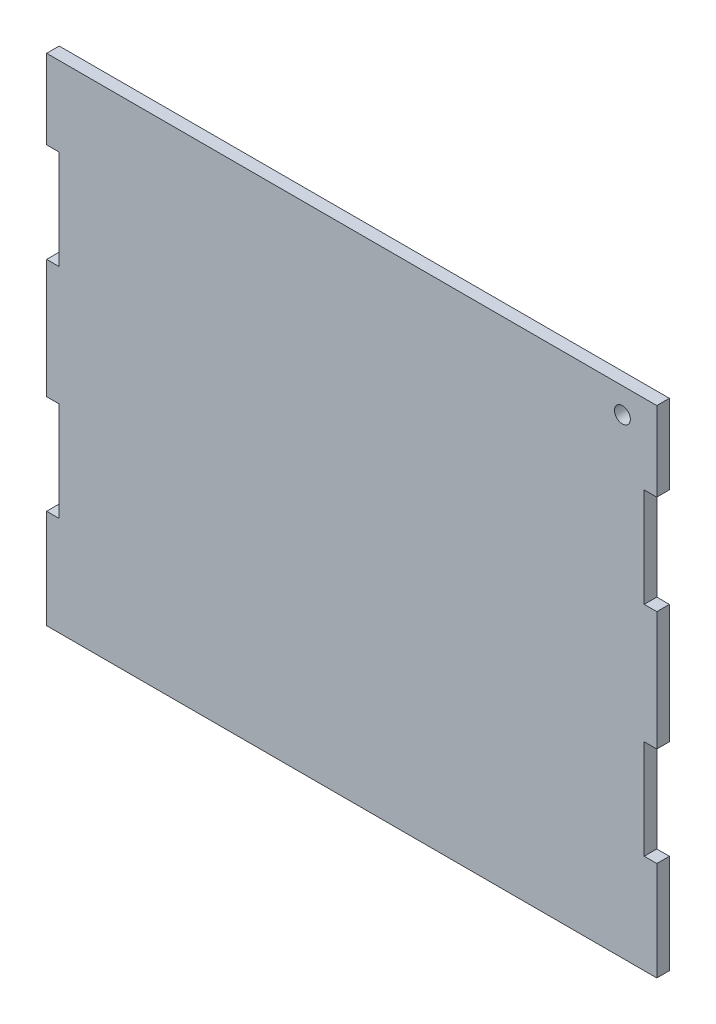
from build123d import *

# Parameters (mm, degrees)
SKETCH1_W           = 307.7
SKETCH1_H           = 250
BOSS_EXTRUDE1_DEPTH = 6.35
SKETCH2_R           = 4
SKETCH2_W           = 6.35
SKETCH2_H           = 50
CUT_EXTRUDE1_DEPTH  = 397.509284254


with BuildPart() as part:
    # Sketch1 → Boss-Extrude1 (new body)
    with BuildSketch(Plane.XY):
        with Locations((153.85, 125)):
            Rectangle(SKETCH1_W, SKETCH1_H)
    extrude(amount=BOSS_EXTRUDE1_DEPTH)

    # Sketch2 → Cut-Extrude1 (cut, through all)
    with BuildSketch(Plane.XY.offset(6.35)):
        with Locations((290.35, 237.3)):
            Circle(SKETCH2_R)
        with Locations((304.525, 75)):
            Rectangle(SKETCH2_W, SKETCH2_H)
        with Locations((304.525, 185)):
            Rectangle(SKETCH2_W, SKETCH2_H)
        with Locations((3.175, 75)):
            Rectangle(SKETCH2_W, SKETCH2_H)
        with Locations((3.175, 185)):
            Rectangle(SKETCH2_W, SKETCH2_H)
    extrude(amount=-CUT_EXTRUDE1_DEPTH, mode=Mode.SUBTRACT)


solid = part.part
